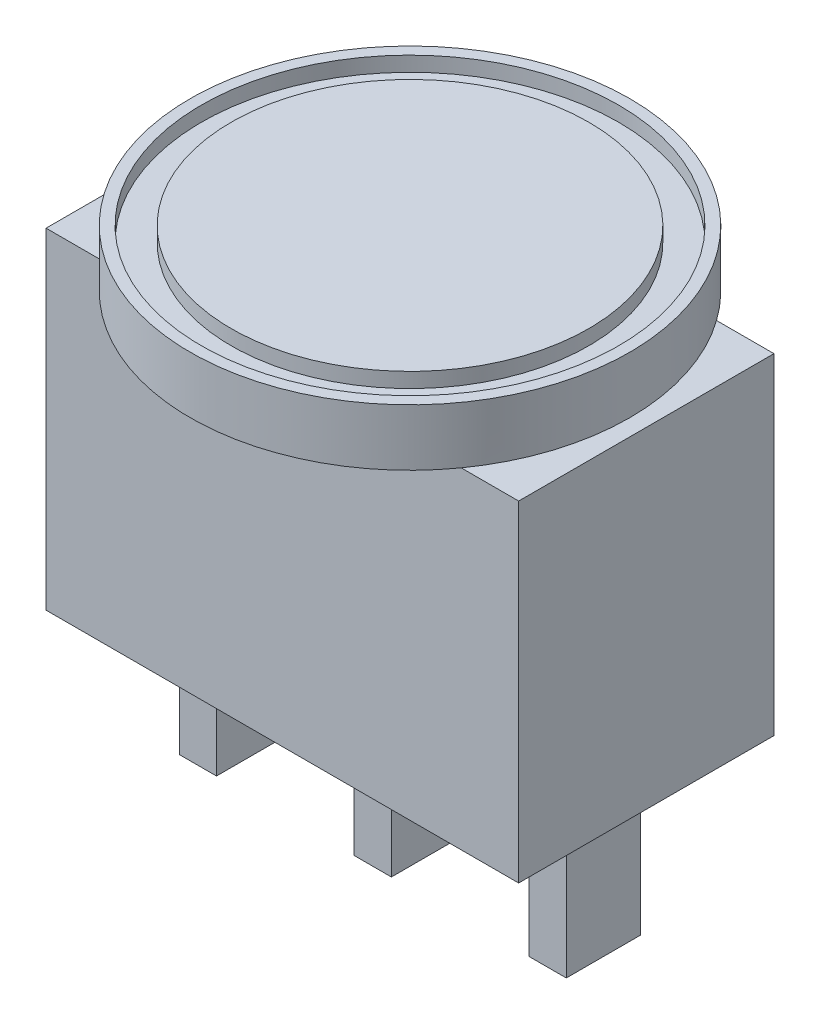
from build123d import *

# Parameters (mm, degrees)
BOSS_EXTRUDE1_DEPTH      = 3.43
BOSS_EXTRUDE1_DEPTH_BACK = 3.43
SKETCH1_W                = 12.7
SKETCH1_H                = 8.89
BOSS_EXTRUDE2_DEPTH      = 1
BOSS_EXTRUDE2_DEPTH_BACK = 1
SKETCH2_W                = 1
SKETCH2_H                = 4


with BuildPart() as part:
    # Sketch1 → Boss-Extrude1 (new, two sides: drawn at the far end of the back side and taken through both)
    with BuildSketch(Plane.XY.offset(-BOSS_EXTRUDE1_DEPTH_BACK)):
        with Locations((0, -4.445)):
            Rectangle(SKETCH1_W, SKETCH1_H)
    extrude(amount=BOSS_EXTRUDE1_DEPTH + BOSS_EXTRUDE1_DEPTH_BACK)

    # Sketch2 → Boss-Extrude2 (add, two sides: drawn at the far end of the back side and taken through both)
    with BuildSketch(Plane.XY.offset(-BOSS_EXTRUDE2_DEPTH_BACK)):
        with Locations((-4.7, -10.89)):
            Rectangle(SKETCH2_W, SKETCH2_H)
        with Locations((0, -10.89)):
            Rectangle(SKETCH2_W, SKETCH2_H)
        with Locations((4.7, -10.89)):
            Rectangle(SKETCH2_W, SKETCH2_H)
    extrude(amount=BOSS_EXTRUDE2_DEPTH + BOSS_EXTRUDE2_DEPTH_BACK)

    # Sketch3 → Revolve1 (revolve)
    with BuildSketch(Plane.XY):
        Polygon((0, 0), (0, 1.524), (4.805, 1.524), (4.805, 1.124), (5.605, 1.124), (5.605, 1.524), (5.905, 1.524), (5.905, 0), align=None)
    revolve(axis=Axis((0, 0, 0), (0, 1, 0)))


solid = part.part
